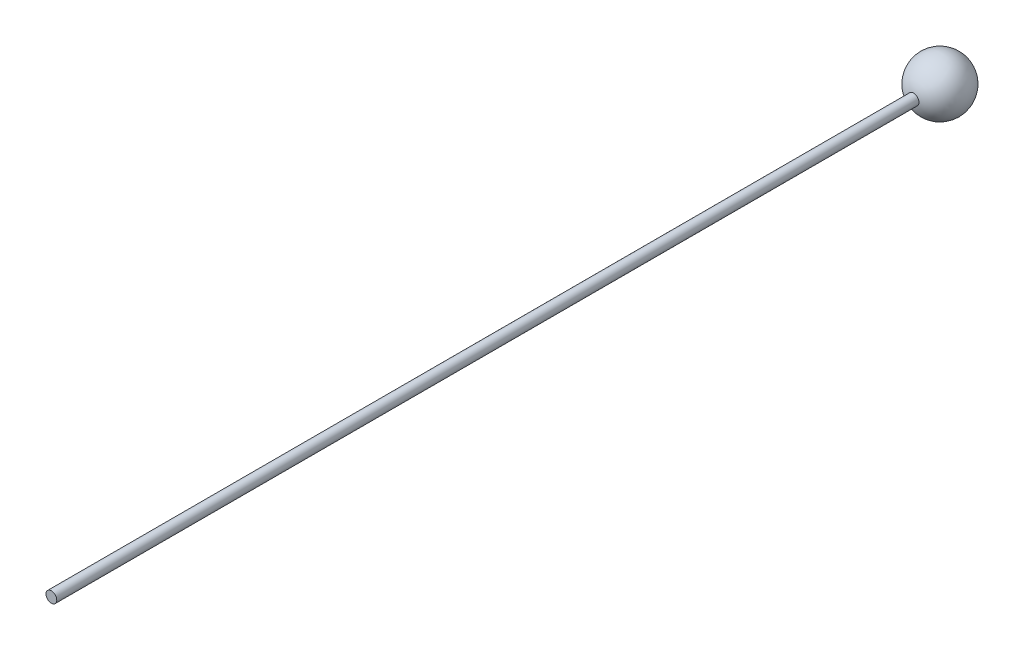
from build123d import *

# Parameters (mm, degrees)
RESSALTO_EXTRUS_O1_REACH      = 87.073
RESSALTO_EXTRUS_O1_END_RADIUS = 2.5
ESBO_O4_R                     = 0.5


with BuildPart() as part:
    # Esboço3 → Revolução1 (revolve)
    with BuildSketch(Plane(origin=(0, 0, 0), x_dir=(-1, 0, 0), z_dir=(0, 1, 0))):
        with BuildLine():
            Line((0, -80), (0, -85))
            ThreePointArc((0, -85), (2.5, -82.5), (0, -80))
        make_face()
    revolve(axis=Axis((0, 0, -80), (0, 0, -1)))

    # Ressalto-extrusão1: up to this sphere (the profile starts outside it)
    ressalto_extrus_o1_end = Location((0, 0, -82.5)) * Sphere(RESSALTO_EXTRUS_O1_END_RADIUS, mode=Mode.PRIVATE)
    # Esboço4 → Ressalto-extrusão1 (add, up to the surface)
    with BuildSketch(Plane(origin=(0, 0, 0), x_dir=(0, 1, 0), z_dir=(0, 0, 1)), mode=Mode.PRIVATE) as ressalto_extrus_o1_sk1:
        with Locations(Location((0, 0, 0), (0, 0, 270))):
            Circle(ESBO_O4_R)
    ressalto_extrus_o1_tool1 = extrude(ressalto_extrus_o1_sk1.sketch, amount=-RESSALTO_EXTRUS_O1_REACH, mode=Mode.PRIVATE) - ressalto_extrus_o1_end
    add(ressalto_extrus_o1_tool1.solids().sort_by_distance((0, 0, 0))[0])


solid = part.part
